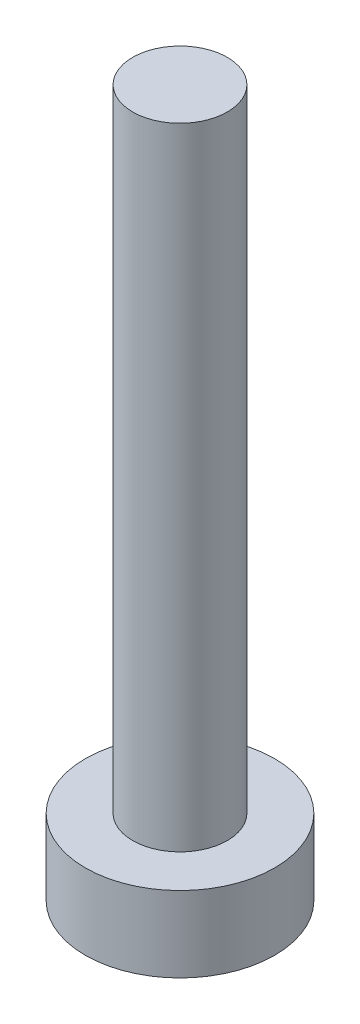
from build123d import *

# Parameters (mm, degrees)
SKETCH_1_R      = 3
EXTRUDE_1_DEPTH = 2.4
SKETCH_2_R      = 1.5
EXTRUDE_2_DEPTH = 20


with BuildPart() as part:
    # Эскиз1 → Бобышка-Вытянуть1 (new body)
    with BuildSketch(Plane(origin=(0, 0, 0), x_dir=(1, 0, 0), z_dir=(0, 1, 0))):
        with Locations(Location((0, 0, 0), (0, 0, 270))):
            Circle(SKETCH_1_R)
    extrude(amount=EXTRUDE_1_DEPTH)

    # Эскиз2 → Бобышка-Вытянуть2 (add)
    with BuildSketch(Plane(origin=(0, 2.4, 0), x_dir=(1, 0, 0), z_dir=(0, 1, 0))):
        with Locations(Location((0, 0, 0), (0, 0, 270))):
            Circle(SKETCH_2_R)
    extrude(amount=EXTRUDE_2_DEPTH)


solid = part.part
